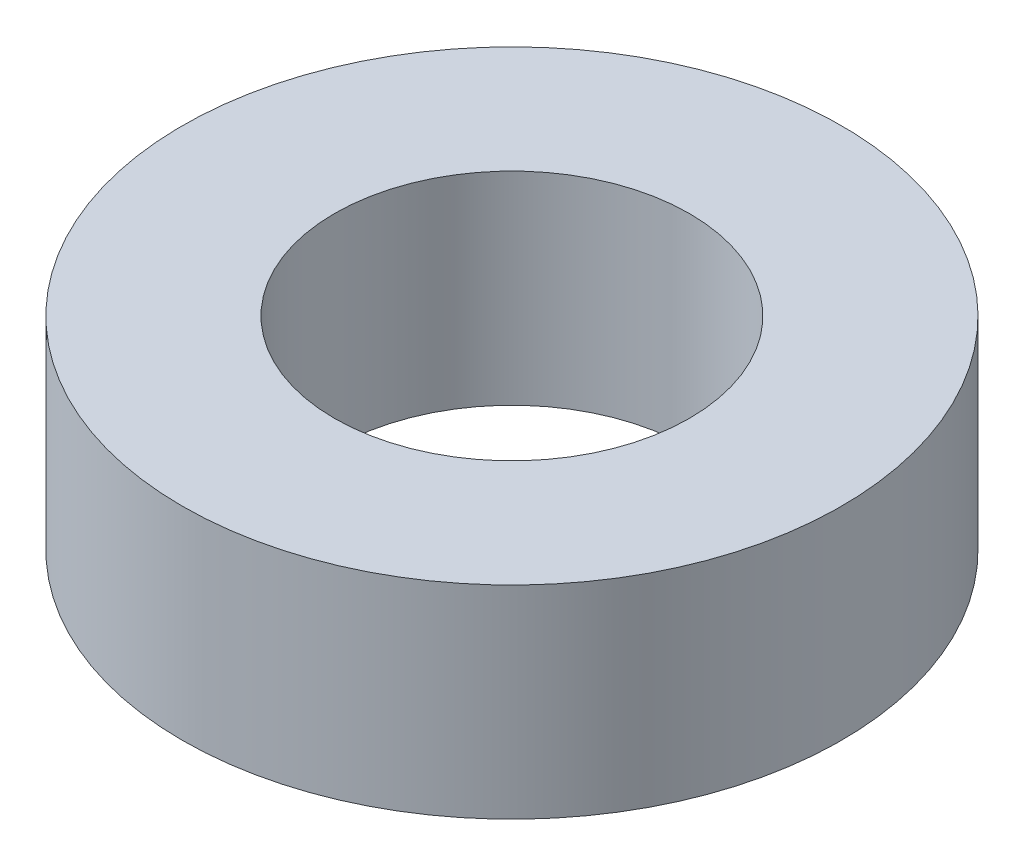
from build123d import *

# Parameters (mm, degrees)
SKETCH1_R           = 6.5
SKETCH1_R_2         = 3.5
BOSS_EXTRUDE1_DEPTH = 4


with BuildPart() as part:
    # Sketch1 → Boss-Extrude1 (new body)
    with BuildSketch(Plane(origin=(0, 0, 0), x_dir=(1, 0, 0), z_dir=(0, 1, 0))):
        with Locations(Location((0, 0, 0), (0, 0, 270))):
            Circle(SKETCH1_R)
        with Locations(Location((0, 0, 0), (0, 0, 270))):
            Circle(SKETCH1_R_2, mode=Mode.SUBTRACT)
    extrude(amount=BOSS_EXTRUDE1_DEPTH)


solid = part.part
